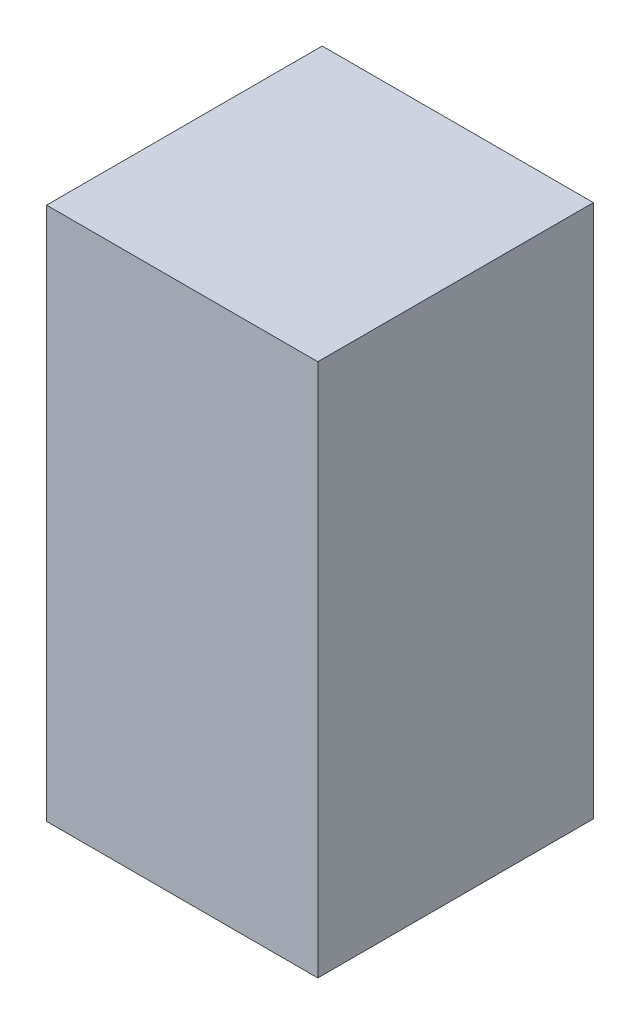
from build123d import *

# Parameters (mm, degrees)
SKETCH1_W           = 61
SKETCH1_H           = 31
BOSS_EXTRUDE1_DEPTH = 31.5


with BuildPart() as part:
    # Sketch1 → Boss-Extrude1 (new body)
    with BuildSketch(Plane(origin=(0, 0, 0), x_dir=(0, 1, 0), z_dir=(0, 0, 1))):
        with Locations((30.5, 15.5)):
            Rectangle(SKETCH1_W, SKETCH1_H)
    extrude(amount=BOSS_EXTRUDE1_DEPTH)


solid = part.part
